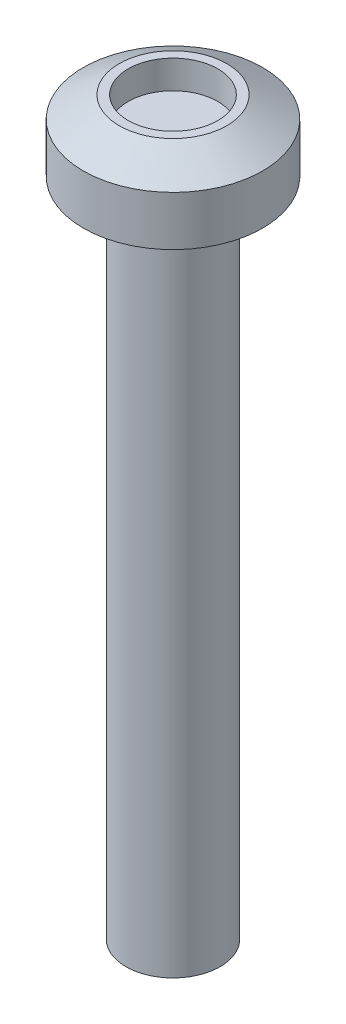
from build123d import *

# Parameters (mm, degrees)
SKETCH2_R          = 0.95
CUT_EXTRUDE1_DEPTH = 0.6


with BuildPart() as part:
    # Sketch1 → Revolve1 (revolve)
    with BuildSketch(Plane.XY, mode=Mode.PRIVATE) as revolve1_sk:
        Polygon((0, -14), (1, -14), (1, 0), (1.9, 0), (1.9, 1.05), (1.14, 1.5), (0, 1.5), align=None)
    revolve(revolve1_sk.sketch.rotate(Axis((0, -10, 0), (0, 1, 0)), 90), axis=Axis((0, -10, 0), (0, 1, 0)))

    # Sketch2 → Cut-Extrude1 (cut)
    with BuildSketch(Plane(origin=(0, 1.5, 0), x_dir=(1, 0, 0), z_dir=(0, 1, 0))):
        with Locations(Location((0, 0, 0), (0, 0, 270))):
            Circle(SKETCH2_R)
    extrude(amount=-CUT_EXTRUDE1_DEPTH, mode=Mode.SUBTRACT)


solid = part.part
